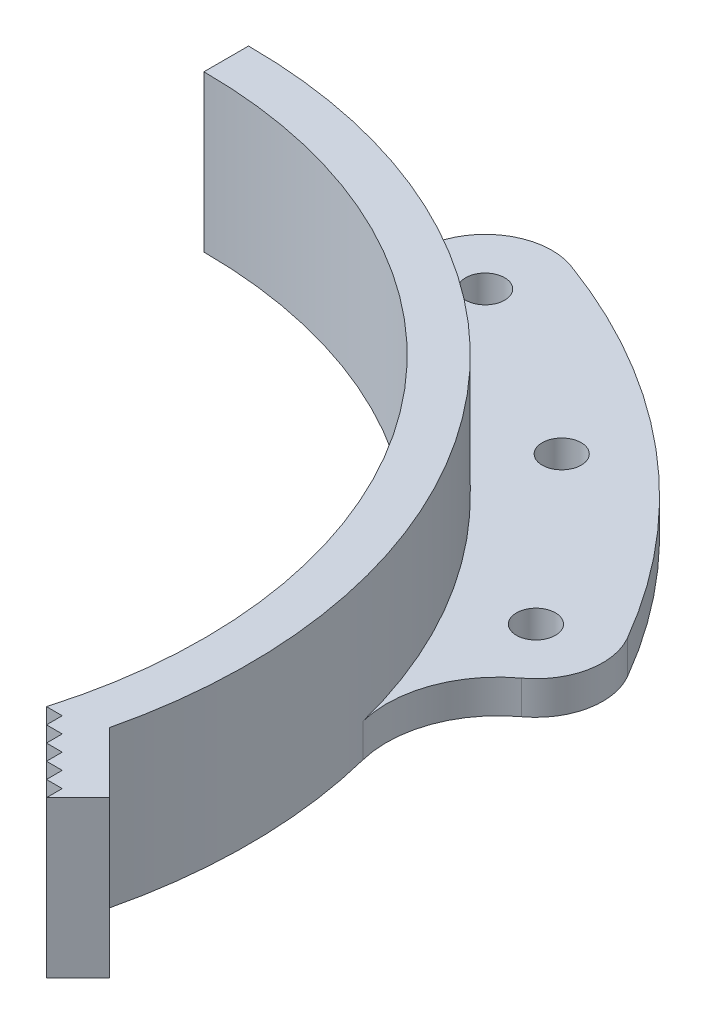
from build123d import *

# Parameters (mm, degrees)
SKETCH_1_R              = 1.75
EXTRUDE_1_DEPTH         = 3
EXTRUDE_2586_DEPTH      = 11
EXTRUDE_2586_DEPTH_BACK = 3
FILLET1_R               = 10


with BuildPart() as part:
    # Эскиз1 → Бобышка-Вытянуть1 (new body)
    with BuildSketch(Plane(origin=(0, 0, 0), x_dir=(1, 0, 0), z_dir=(0, 1, 0))):
        with BuildLine():
            Line((0, 48), (0, 52))
            ThreePointArc((0, 52), (6.283445482, 51.618972412), (12.474807654, 50.481473572))
            ThreePointArc((12.474807654, 50.481473572), (14.921144436, 55.582006519), (20.5212086, 56.381557247))
            ThreePointArc((20.5212086, 56.381557247), (38.567256581, 45.962666587), (51.961524227, 30))
            ThreePointArc((51.961524227, 30), (49.765371804, 21.803847577), (41.569219382, 24))
            ThreePointArc((41.569219382, 24), (24, 41.569219382), (0, 48))
        make_face()
        with Locations(Location((34.710530923, 41.366399928, 0), (0, 0, 270))):
            Circle(SKETCH_1_R, mode=Mode.SUBTRACT)
        with Locations(Location((18.46908774, 50.743401522, 0), (0, 0, 270))):
            Circle(SKETCH_1_R, mode=Mode.SUBTRACT)
        with Locations(Location((46.765371804, 27, 0), (0, 0, 270))):
            Circle(SKETCH_1_R, mode=Mode.SUBTRACT)
    extrude(amount=EXTRUDE_1_DEPTH)

    # Эскиз2 → Extrude 2586 (add, two sides: drawn at the far end of the back side and taken through both)
    with BuildSketch(Plane(origin=(0, 3, 0), x_dir=(1, 0, 0), z_dir=(0, 1, 0)).offset(-EXTRUDE_2586_DEPTH_BACK)):
        with BuildLine():
            Line((49.302845964, -19.419222091), (49.302845964, -18.005008529))
            Line((49.302845964, -18.005008529), (47.888632402, -18.005008529))
            Line((47.888632402, -18.005008529), (47.888632402, -16.590794966))
            Line((47.888632402, -16.590794966), (46.474418839, -16.590794966))
            Line((46.474418839, -16.590794966), (46.474418839, -15.176581404))
            Line((46.474418839, -15.176581404), (45.060205277, -15.176581404))
            Line((45.060205277, -15.176581404), (45.060205277, -13.762367842))
            Line((45.060205277, -13.762367842), (43.645991715, -13.762367842))
            Line((43.645991715, -13.762367842), (43.645991715, -12.348154279))
            Line((43.645991715, -12.348154279), (42.231778152, -12.348154279))
            ThreePointArc((42.231778152, -12.348154279), (35.208797113, 26.388266443), (0, 44))
            Line((0, 44), (0, 48))
            ThreePointArc((0, 48), (37.676689525, 29.73999103), (46.687683687, -11.147205565))
            Line((46.687683687, -11.147205565), (52.131273089, -16.590794966))
            Line((52.131273089, -16.590794966), (49.302845964, -19.419222091))
        make_face()
    extrude(amount=EXTRUDE_2586_DEPTH + EXTRUDE_2586_DEPTH_BACK)

    # Fillet1
    fillet1_edges = [part.edges().sort_by_distance(p)[0] for p in [
        (41.569219382, 1.5, -24),
    ]]
    fillet(fillet1_edges, radius=FILLET1_R)


solid = part.part
